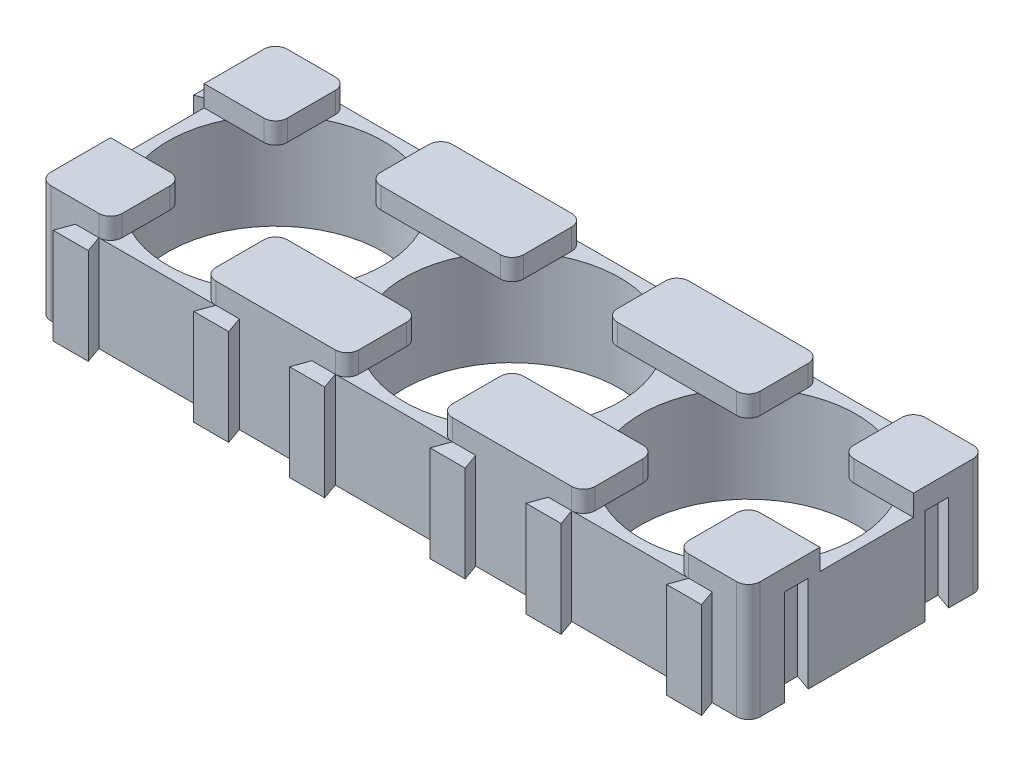
from build123d import *

# Parameters (mm, degrees)
SKETCH1_R           = 9.2
BOSS_EXTRUDE1_DEPTH = 8.2
BOSS_EXTRUDE2_DEPTH = 1.8
LPATTERN1_COUNT     = 3
LPATTERN1_PITCH     = 20.2
FILLET1_R           = 1
CUT_EXTRUDE1_DEPTH  = 8.2


with BuildPart() as part:
    # Sketch1 → Boss-Extrude1 (new body)
    with BuildSketch(Plane(origin=(0, 0, 0), x_dir=(1, 0, 0), z_dir=(0, 1, 0))):
        Polygon((-9.1, 10.1), (-7, 10.1), (-7.5, 8.7), (-4.5, 8.7), (-5, 10.1), (5, 10.1), (4.5, 8.7), (7.5, 8.7), (7, 10.1), (9.1, 10.1), (10.1, 10.1), (10.1, 9.1), (10.1, 7), (10.1, 5), (10.1, -5), (10.1, -7), (10.1, -9.1), (10.1, -10.1), (9.1, -10.1), (7, -10.1), (7.5, -11.5), (4.5, -11.5), (5, -10.1), (-5, -10.1), (-4.5, -11.5), (-7.5, -11.5), (-7, -10.1), (-9.1, -10.1), (-10.1, -10.1), (-10.1, -9.1), (-10.1, -7), (-11.5, -7.5), (-11.5, -4.5), (-10.1, -5), (-10.1, 5), (-11.5, 4.5), (-11.5, 7.5), (-10.1, 7), (-10.1, 9.1), (-10.1, 10.1), align=None)
        with Locations(Location((0, 0, 0), (0, 0, 270))):
            Circle(SKETCH1_R, mode=Mode.SUBTRACT)
    boss_extrude1 = extrude(amount=BOSS_EXTRUDE1_DEPTH)

    # Sketch2 → Boss-Extrude2 (add)
    with BuildSketch(Plane(origin=(0, 8.2, 0), x_dir=(1, 0, 0), z_dir=(0, 1, 0))):
        with BuildLine():
            Line((-9.1, 4), (-5, 4))
            ThreePointArc((-5, 4), (-4.292893219, 4.292893219), (-4, 5))
            Line((-4, 5), (-4, 9.1))
            ThreePointArc((-4, 9.1), (-4.292893219, 9.807106781), (-5, 10.1))
            Line((-5, 10.1), (-9.1, 10.1))
            Line((-9.1, 10.1), (-10.1, 10.1))
            Line((-10.1, 10.1), (-10.1, 9.1))
            Line((-10.1, 9.1), (-10.1, 5))
            Line((-10.1, 5), (-10.1, 4))
            Line((-10.1, 4), (-9.1, 4))
        make_face()
        with BuildLine():
            Line((9.1, 10.1), (10.1, 10.1))
            Line((10.1, 10.1), (10.1, 4))
            Line((10.1, 4), (9.1, 4))
            Line((9.1, 4), (5, 4))
            ThreePointArc((5, 4), (4.292893219, 4.292893219), (4, 5))
            Line((4, 5), (4, 9.1))
            ThreePointArc((4, 9.1), (4.292893219, 9.807106781), (5, 10.1))
            Line((5, 10.1), (9.1, 10.1))
        make_face()
        with BuildLine():
            Line((9.1, -4), (5, -4))
            ThreePointArc((5, -4), (4.292893219, -4.292893219), (4, -5))
            Line((4, -5), (4, -9.1))
            ThreePointArc((4, -9.1), (4.292893219, -9.807106781), (5, -10.1))
            Line((5, -10.1), (9.1, -10.1))
            Line((9.1, -10.1), (10.1, -10.1))
            Line((10.1, -10.1), (10.1, -4))
            Line((10.1, -4), (9.1, -4))
        make_face()
        with BuildLine():
            Line((-4, -5), (-4, -9.1))
            ThreePointArc((-4, -9.1), (-4.292893219, -9.807106781), (-5, -10.1))
            Line((-5, -10.1), (-9.1, -10.1))
            Line((-9.1, -10.1), (-10.1, -10.1))
            Line((-10.1, -10.1), (-10.1, -9.1))
            Line((-10.1, -9.1), (-10.1, -5))
            Line((-10.1, -5), (-10.1, -4))
            Line((-10.1, -4), (-9.1, -4))
            Line((-9.1, -4), (-5, -4))
            ThreePointArc((-5, -4), (-4.292893219, -4.292893219), (-4, -5))
        make_face()
    boss_extrude2 = extrude(amount=BOSS_EXTRUDE2_DEPTH)

    # LPattern1: Boss-Extrude1, Boss-Extrude2 ×3
    with Locations(*[(i * LPATTERN1_PITCH, 0, 0) for i in range(1, LPATTERN1_COUNT)]):
        add(boss_extrude1)
        add(boss_extrude2)

    # Fillet1
    fillet1_edges = [part.edges().sort_by_distance(p)[0] for p in [
        (50.5, 5, 10.1),
        (50.5, 5, -10.1),
        (-10.1, 5, 10.1),
        (-10.1, 5, -10.1),
    ]]
    fillet(fillet1_edges, radius=FILLET1_R)

    # Sketch5 → Cut-Extrude1 (cut)
    with BuildSketch(Plane.XZ):
        Polygon((50.5, -5), (49.1, -4.5), (49.1, -7.5), (50.5, -7), align=None)
    cut_extrude1 = extrude(amount=-CUT_EXTRUDE1_DEPTH, mode=Mode.SUBTRACT)

    # Mirror1: Cut-Extrude1 across plane
    add(cut_extrude1.mirror(Plane.XY), mode=Mode.SUBTRACT)


solid = part.part
